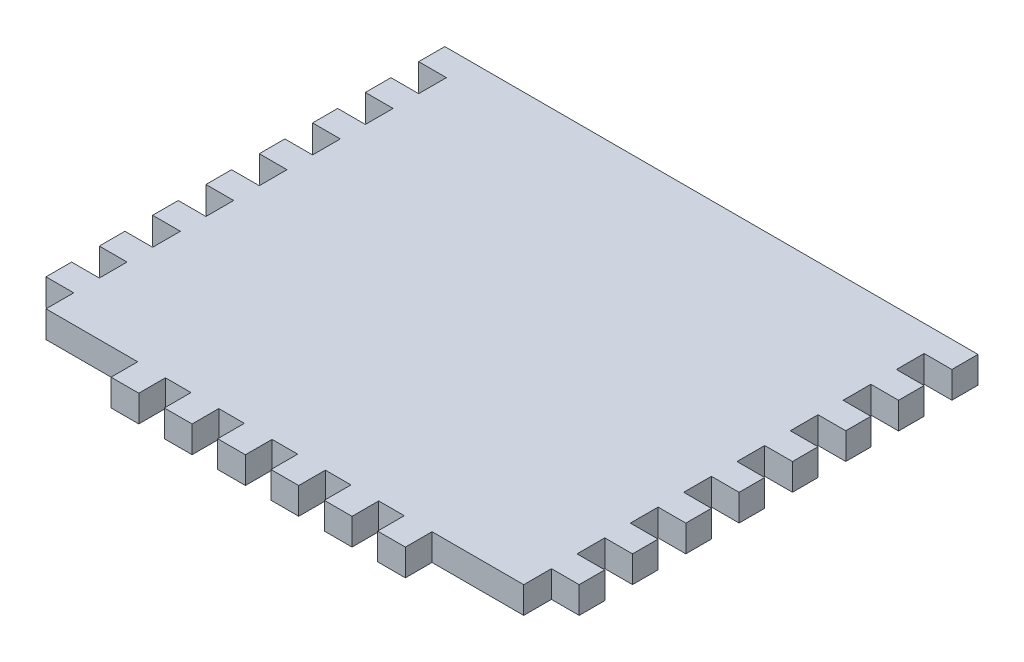
from build123d import *

# Parameters (mm, degrees)
SKETCH1_W               = 127
SKETCH1_H               = 107.95
BOSS_EXTRUDE1_DEPTH     = 6.35
CUT_EXTRUDE1_DEPTH      = 84.58153579
CUT_EXTRUDE1_DEPTH_BACK = 84.58153579
SKETCH2_W               = 6.604
SKETCH2_H               = 6.604


with BuildPart() as part:
    # Sketch1 → Boss-Extrude1 (new body)
    with BuildSketch(Plane(origin=(0, 0, 0), x_dir=(1, 0, 0), z_dir=(0, 1, 0))):
        Rectangle(SKETCH1_W, SKETCH1_H)
    extrude(amount=BOSS_EXTRUDE1_DEPTH)

    # Sketch2 → Cut-Extrude1 (cut, two sides: drawn at the far end of the back side and taken through both)
    with BuildSketch(Plane(origin=(0, 6.35, 0), x_dir=(1, 0, 0), z_dir=(0, 1, 0)).offset(-CUT_EXTRUDE1_DEPTH_BACK)):
        Polygon((22.352, -47.625), (28.448, -47.625), (28.448, -54.229), (35.052, -54.229), (35.052, -47.625), (56.896, -47.625), (56.896, -41.021), (63.5, -41.021), (63.5, -47.625), (63.5, -92.544961432), (-63.5, -92.544961432), (-63.5, -47.625), (-63.5, -41.021), (-56.896, -41.021), (-56.896, -47.625), (-35.052, -47.625), (-35.052, -54.229), (-28.448, -54.229), (-28.448, -47.625), (-22.352, -47.625), (-22.352, -54.229), (-15.748, -54.229), (-15.748, -47.625), (-9.652, -47.625), (-9.652, -54.229), (-3.048, -54.229), (-3.048, -47.625), (3.048, -47.625), (3.048, -54.229), (9.652, -54.229), (9.652, -47.625), (15.748, -47.625), (15.748, -54.229), (22.352, -54.229), align=None)
        with Locations((-60.198, 31.75)):
            Rectangle(SKETCH2_W, SKETCH2_H)
        with Locations((-60.198, 19.177)):
            Rectangle(SKETCH2_W, SKETCH2_H)
        with Locations((-60.198, 6.477)):
            Rectangle(SKETCH2_W, SKETCH2_H)
        with Locations((-60.198, -6.223)):
            Rectangle(SKETCH2_W, SKETCH2_H)
        with Locations((-60.198, -18.923)):
            Rectangle(SKETCH2_W, SKETCH2_H)
        with Locations((-60.198, -31.623)):
            Rectangle(SKETCH2_W, SKETCH2_H)
        with Locations((60.198, -31.623)):
            Rectangle(SKETCH2_W, SKETCH2_H)
        with Locations((60.198, -18.923)):
            Rectangle(SKETCH2_W, SKETCH2_H)
        with Locations((60.198, -6.223)):
            Rectangle(SKETCH2_W, SKETCH2_H)
        with Locations((60.198, 6.477)):
            Rectangle(SKETCH2_W, SKETCH2_H)
        with Locations((60.198, 19.177)):
            Rectangle(SKETCH2_W, SKETCH2_H)
        with Locations((60.198, 31.75)):
            Rectangle(SKETCH2_W, SKETCH2_H)
        with Locations((60.198, 44.45)):
            Rectangle(SKETCH2_W, SKETCH2_H)
        with Locations((-60.198, 44.45)):
            Rectangle(SKETCH2_W, SKETCH2_H)
    extrude(amount=CUT_EXTRUDE1_DEPTH + CUT_EXTRUDE1_DEPTH_BACK, mode=Mode.SUBTRACT)


solid = part.part
